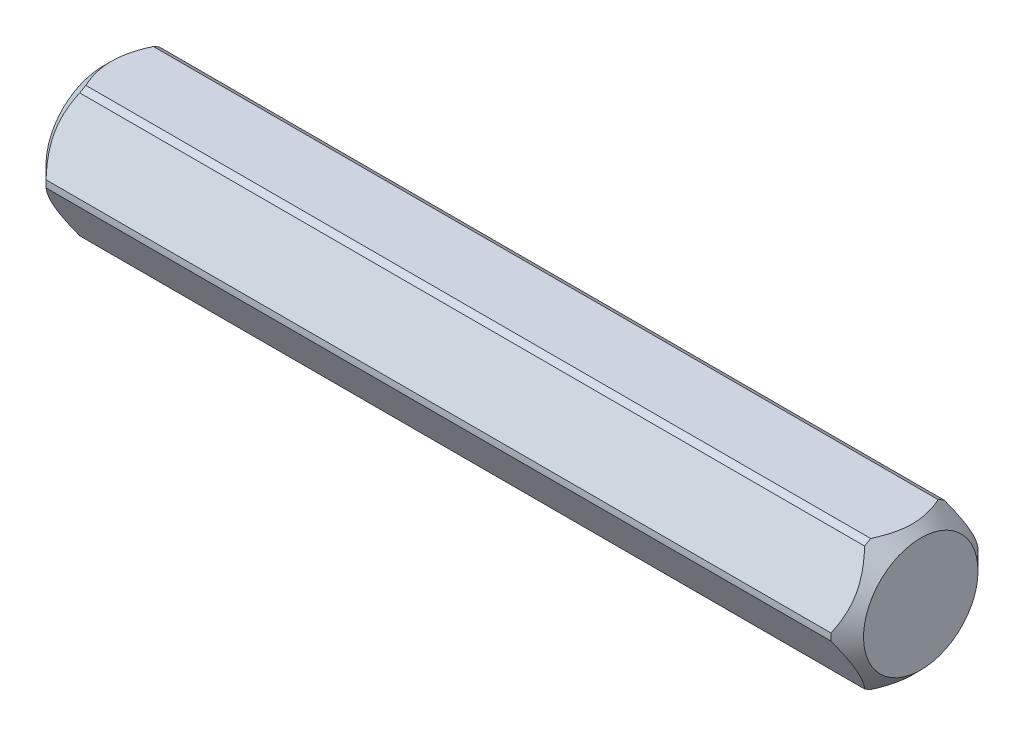
from build123d import *

# Parameters (mm, degrees)
EXTRUDE_306_DEPTH          = 25
CUT_EXTRUDE_407_DEPTH      = 26.735837529
CUT_EXTRUDE_407_DEPTH_BACK = 26.735837529
SKETCH_8_R                 = 5.5
SKETCH_8_R_2               = 4.5


with BuildPart() as part:
    # 草图1 → Extrude 306 (new, symmetric)
    with BuildSketch(Plane(origin=(0, 0, 0), x_dir=(0, 0, -1), z_dir=(1, 0, 0))):
        Polygon((4.618802154, 0), (2.309401077, 4), (-2.309401077, 4), (-4.618802154, 0), (-2.309401077, -4), (2.309401077, -4), align=None)
    extrude(amount=EXTRUDE_306_DEPTH, both=True)

    # 草图8 → Cut-Extrude 407 (cut, two sides: drawn at the far end of the back side and taken through both)
    with BuildSketch(Plane(origin=(0, 0, 0), x_dir=(0, 0, -1), z_dir=(1, 0, 0)).offset(-CUT_EXTRUDE_407_DEPTH_BACK)):
        Circle(SKETCH_8_R)
        Circle(SKETCH_8_R_2, mode=Mode.SUBTRACT)
    extrude(amount=CUT_EXTRUDE_407_DEPTH + CUT_EXTRUDE_407_DEPTH_BACK, mode=Mode.SUBTRACT)

    # 草图10 → Cut-Revolve 698 (revolve, cut)
    with BuildSketch(Plane.XY, mode=Mode.PRIVATE) as cut_revolve_698_sk:
        Polygon((-25.5, 4.5), (-24, 4.5), (-25.5, 3), align=None)
        Polygon((24, 4.5), (25.5, 3), (25.5, 4.5), align=None)
    revolve(cut_revolve_698_sk.sketch.rotate(Axis((25, 0, 0), (-1, 0, 0)), 267.266044451), axis=Axis((25, 0, 0), (-1, 0, 0)), mode=Mode.SUBTRACT)


solid = part.part
